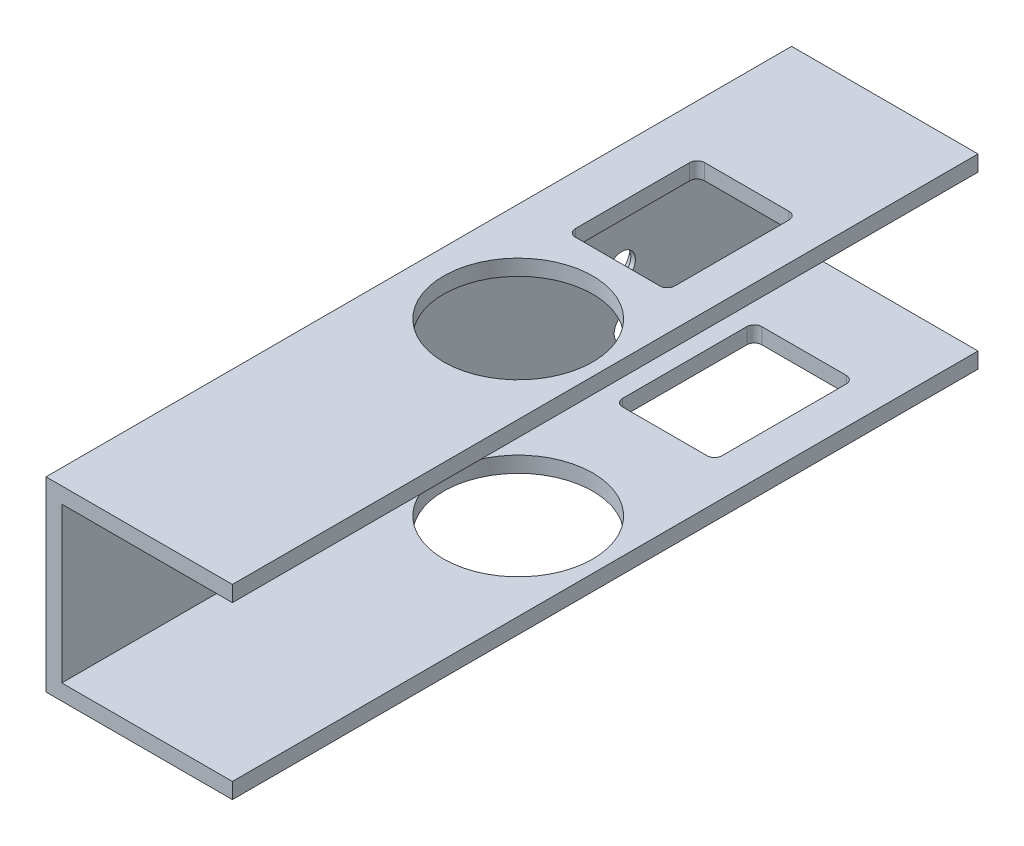
from build123d import *

# Parameters (mm, degrees)
BOSS_EXTRUDE1_DEPTH                                  = 300
SKETCH2_R                                            = 30
CUT_EXTRUDE1_DEPTH                                   = 319.198051534
SKETCH3_W                                            = 40
SKETCH3_H                                            = 56
CUT_EXTRUDE2_DEPTH                                   = 10
SKETCH4_W                                            = 40
SKETCH4_H                                            = 52
CUT_EXTRUDE3_DEPTH                                   = 10
FILLET1_R                                            = 3
CSK_FOR_M10_COUNTERSUNK_FLAT_HEAD_SCREW1_D           = 11
CSK_FOR_M10_COUNTERSUNK_FLAT_HEAD_SCREW1_DEPTH       = 20.003
CSK_FOR_M10_COUNTERSUNK_FLAT_HEAD_SCREW1_CSINK_D     = 20
CSK_FOR_M10_COUNTERSUNK_FLAT_HEAD_SCREW1_CSINK_ANGLE = 90
CSK_FOR_M10_COUNTERSUNK_FLAT_HEAD_SCREW1_TIP         = 3.304733405


with BuildPart() as part:
    # Sketch1 → Boss-Extrude1 (new body)
    with BuildSketch(Plane.XY):
        Polygon((0, -37.5), (0, 37.5), (75, 37.5), (75, 31.15), (6.35, 31.15), (6.35, -31.15), (75, -31.15), (75, -37.5), align=None)
    extrude(amount=BOSS_EXTRUDE1_DEPTH)

    # Sketch2 → Cut-Extrude1 (cut, through all)
    with BuildSketch(Plane(origin=(0, 37.5, 0), x_dir=(1, 0, 0), z_dir=(0, 1, 0))):
        with Locations(Location((40, -150, 0), (0, 0, 270))):
            Circle(SKETCH2_R)
    extrude(amount=-CUT_EXTRUDE1_DEPTH, mode=Mode.SUBTRACT)

    # Sketch3 → Cut-Extrude2 (cut)
    with BuildSketch(Plane.XZ.offset(37.5)):
        with Locations((40, 63)):
            Rectangle(SKETCH3_W, SKETCH3_H)
    extrude(amount=-CUT_EXTRUDE2_DEPTH, mode=Mode.SUBTRACT)

    # Sketch4 → Cut-Extrude3 (cut)
    with BuildSketch(Plane(origin=(0, 37.5, 0), x_dir=(1, 0, 0), z_dir=(0, 1, 0))):
        with Locations((40, -84)):
            Rectangle(SKETCH4_W, SKETCH4_H)
    extrude(amount=-CUT_EXTRUDE3_DEPTH, mode=Mode.SUBTRACT)

    # Fillet1
    fillet1_edges = [part.edges().sort_by_distance(p)[0] for p in [
        (20, -34.325, 91),
        (60, -34.325, 91),
        (60, -34.325, 35),
        (20, -34.325, 35),
        (60, 34.325, 110),
        (20, 34.325, 110),
        (20, 34.325, 58),
        (60, 34.325, 58),
    ]]
    fillet(fillet1_edges, radius=FILLET1_R)

    # CSK for M10 Countersunk Flat Head Screw1
    with Locations(Plane.ZY):
        with Locations((74.704121605, 1.01110333), (72.25, -20.6), (79.836004025, 23.188381743)):
            CounterSinkHole(CSK_FOR_M10_COUNTERSUNK_FLAT_HEAD_SCREW1_D / 2, CSK_FOR_M10_COUNTERSUNK_FLAT_HEAD_SCREW1_CSINK_D / 2, depth=CSK_FOR_M10_COUNTERSUNK_FLAT_HEAD_SCREW1_DEPTH, counter_sink_angle=CSK_FOR_M10_COUNTERSUNK_FLAT_HEAD_SCREW1_CSINK_ANGLE)
            with Locations((0, 0, -(CSK_FOR_M10_COUNTERSUNK_FLAT_HEAD_SCREW1_DEPTH + CSK_FOR_M10_COUNTERSUNK_FLAT_HEAD_SCREW1_TIP / 2))):  # 118° drill point
                Cone(0, CSK_FOR_M10_COUNTERSUNK_FLAT_HEAD_SCREW1_D / 2, CSK_FOR_M10_COUNTERSUNK_FLAT_HEAD_SCREW1_TIP, mode=Mode.SUBTRACT)


solid = part.part
